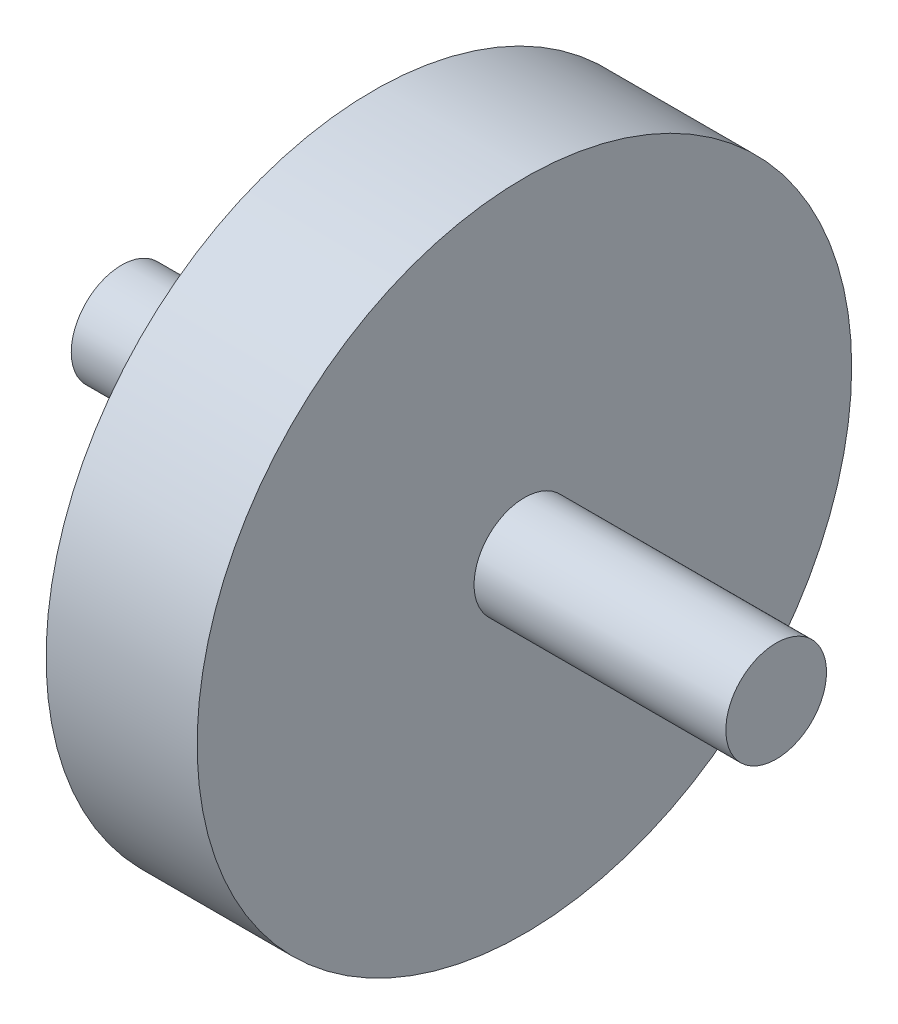
from build123d import *

# Parameters (mm, degrees)
SKETCH1_R           = 65
BOSS_EXTRUDE1_DEPTH = 30
SKETCH2_R           = 10
BOSS_EXTRUDE2_DEPTH = 50
BOSS_EXTRUDE3_START = 50
SKETCH3_R           = 10
BOSS_EXTRUDE3_DEPTH = 50


with BuildPart() as part:
    # Sketch1 → Boss-Extrude1 (new body)
    with BuildSketch(Plane(origin=(0, 0, 0), x_dir=(0, 0, -1), z_dir=(1, 0, 0))):
        Circle(SKETCH1_R)
    extrude(amount=BOSS_EXTRUDE1_DEPTH)

    # Sketch2 → Boss-Extrude2 (add)
    with BuildSketch(Plane(origin=(30, 0, 0), x_dir=(0, 0, -1), z_dir=(1, 0, 0))):
        Circle(SKETCH2_R)
    extrude(amount=BOSS_EXTRUDE2_DEPTH)

    # Sketch3 → Boss-Extrude3 (add)
    with BuildSketch(Plane.ZY.offset(BOSS_EXTRUDE3_START)):
        with Locations(Location((0, 0, 0), (0, 0, 180))):
            Circle(SKETCH3_R)
    extrude(amount=-BOSS_EXTRUDE3_DEPTH)


solid = part.part
